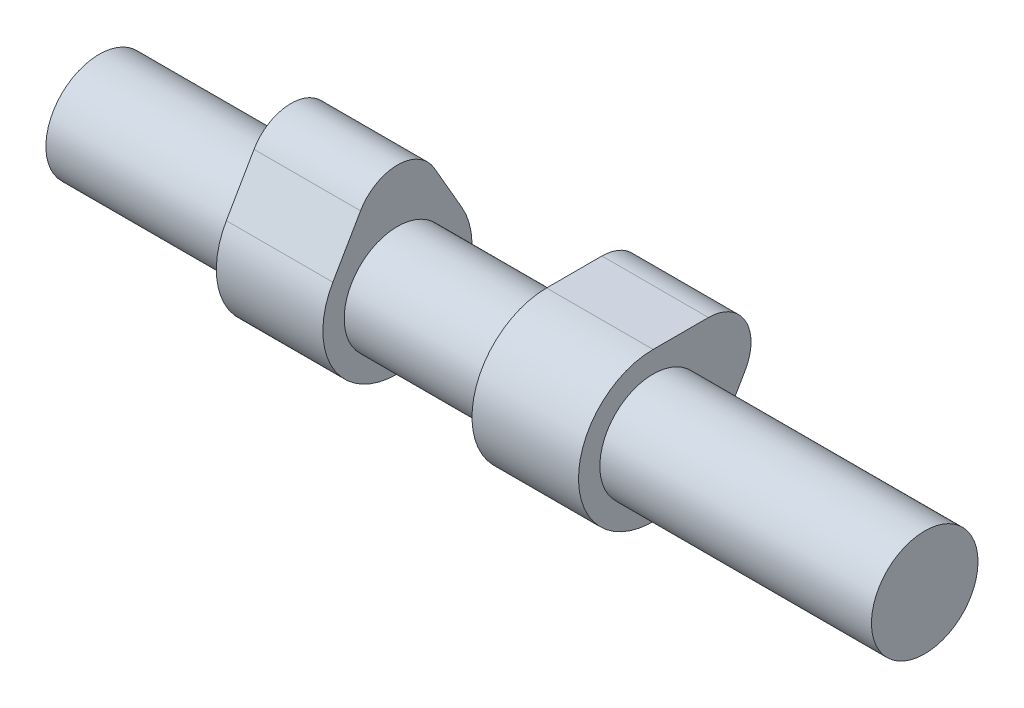
from build123d import *

# Parameters (mm, degrees)
SKETCH2_R             = 5
BOSS_EXTRUDE1_DEPTH   = 10
BODY_MOVE_COPY2_ANGLE = 60
BOSS_EXTRUDE2_START   = 28
SKETCH3_R             = 5
BOSS_EXTRUDE2_DEPTH   = 80
SKETCH4_R             = 5
CUT_EXTRUDE1_DEPTH    = 2.5


with BuildPart() as part:
    # Sketch2 → Boss-Extrude1 (new body)
    with BuildSketch(Plane.YZ):
        with BuildLine():
            Line((-3.5, -6.062177826), (1, -8.660254038))
            ThreePointArc((1, -8.660254038), (5, -8.660254038), (7, -5.196152423))
            Line((7, -5.196152423), (7, 0))
            ThreePointArc((7, 0), (-3.5, 6.062177826), (-3.5, -6.062177826))
        make_face()
        with Locations(Location((0, 0, 0), (0, 0, 270))):
            Circle(SKETCH2_R, mode=Mode.SUBTRACT)
    extrude(amount=-BOSS_EXTRUDE1_DEPTH)


with BuildPart() as body_2:
    # Body-Move/Copy1: copy of part
    add(part.part.moved(Location((-24, 0, 0))))


with BuildPart() as body_2_1:
    # Body-Move/Copy2: moved
    add(body_2.part.rotate(Axis((0, 0, 0), (1, 0, 0)), BODY_MOVE_COPY2_ANGLE))


with BuildPart() as part_1:
    add(part.part)

    add(body_2_1.part)  # Boss-Extrude2 merges body 2
    # Sketch3 → Boss-Extrude2 (add)
    with BuildSketch(Plane.YZ.offset(BOSS_EXTRUDE2_START)):
        with Locations(Location((0, 0, 0), (0, 0, 270))):
            Circle(SKETCH3_R)
    extrude(amount=-BOSS_EXTRUDE2_DEPTH)

    # Sketch4 → Cut-Extrude1 (cut)
    with BuildSketch(Plane.YZ.offset(28)):
        with Locations(Location((0, 0, 0), (0, 0, 270))):
            Circle(SKETCH4_R)
    extrude(amount=-CUT_EXTRUDE1_DEPTH, mode=Mode.SUBTRACT)


solid = part_1.part
